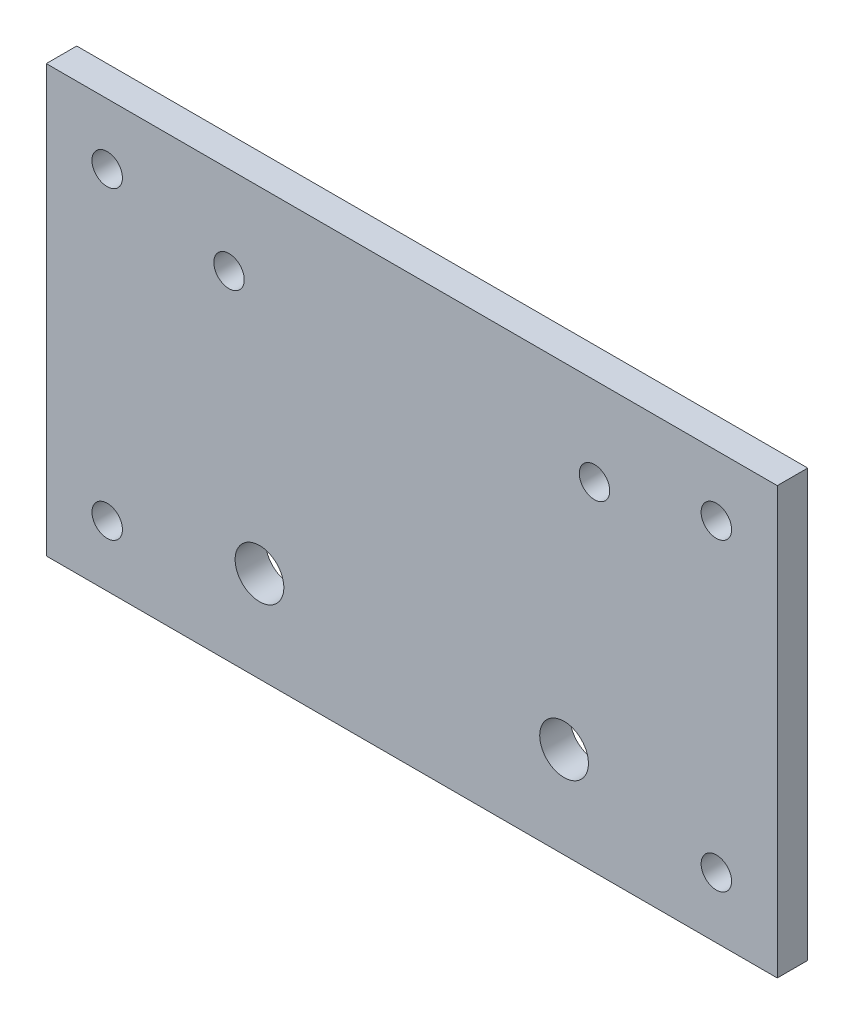
from build123d import *

# Parameters (mm, degrees)
SKETCH1_R           = 4
SKETCH1_R_2         = 2.5
BOSS_EXTRUDE1_DEPTH = 5


with BuildPart() as part:
    # Sketch1 → Boss-Extrude1 (new body)
    with BuildSketch(Plane.XY):
        Polygon((0, 0), (39, 0), (81, 0), (120, 0), (120, -70), (0, -70), align=None)
        with Locations((35, -55)):
            Circle(SKETCH1_R, mode=Mode.SUBTRACT)
        with Locations(Location((85, -55, 0), (0, 0, 180))):
            Circle(SKETCH1_R, mode=Mode.SUBTRACT)
        with Locations((10, -10)):
            Circle(SKETCH1_R_2, mode=Mode.SUBTRACT)
        with Locations(Location((110, -10, 0), (0, 0, 180))):
            Circle(SKETCH1_R_2, mode=Mode.SUBTRACT)
        with Locations((110, -60)):
            Circle(SKETCH1_R_2, mode=Mode.SUBTRACT)
        with Locations(Location((10, -60, 0), (0, 0, 180))):
            Circle(SKETCH1_R_2, mode=Mode.SUBTRACT)
        with Locations((30, -14.5)):
            Circle(SKETCH1_R_2, mode=Mode.SUBTRACT)
        with Locations(Location((90, -14.5, 0), (0, 0, 180))):
            Circle(SKETCH1_R_2, mode=Mode.SUBTRACT)
    extrude(amount=BOSS_EXTRUDE1_DEPTH)


solid = part.part
